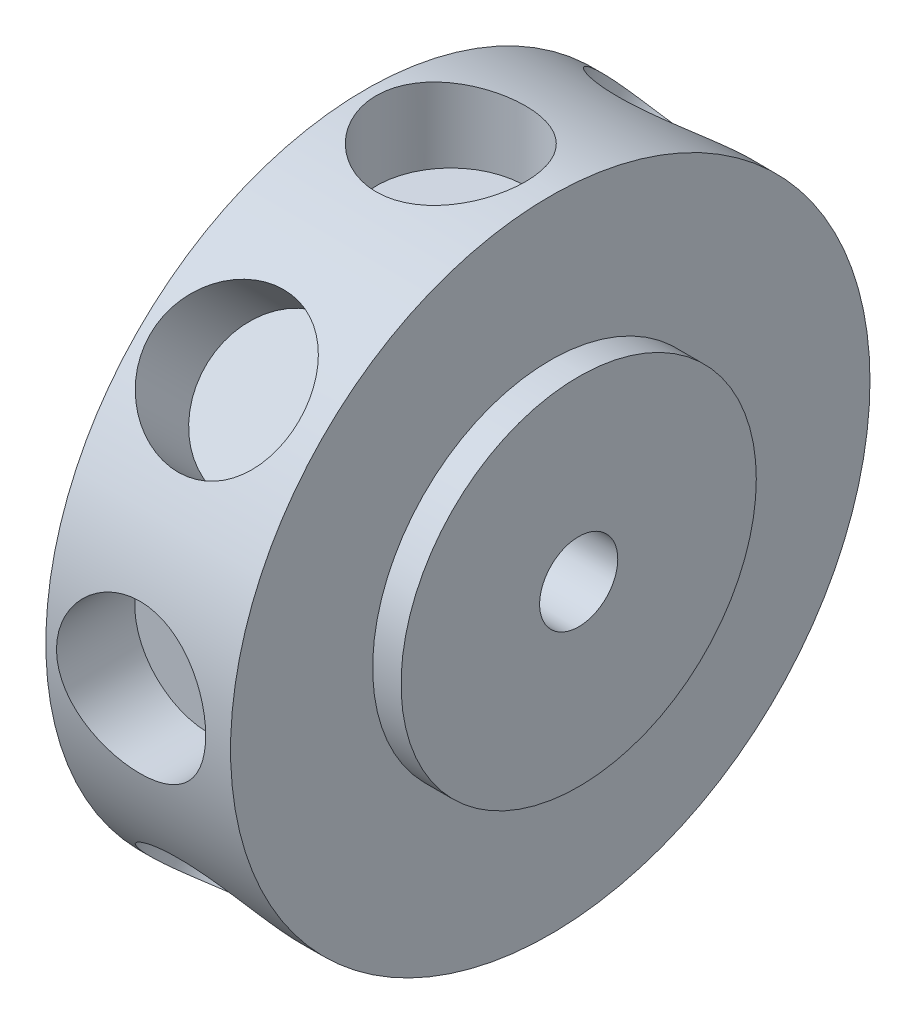
from build123d import *

# Parameters (mm, degrees)
SKETCH1_R               = 22.5
BOSS_EXTRUDE1_DEPTH     = 15
SKETCH2_R               = 2.75
CUT_EXTRUDE1_DEPTH      = 36.178118199
SKETCH5_R               = 8.1
CUT_EXTRUDE2_DEPTH      = 5.5
SKETCH6_R               = 5.25
CUT_EXTRUDE3_DEPTH      = 5.5
CIRPATTERN1_COUNT       = 8
SKETCH29_R              = 22.5
SKETCH29_R_2            = 12.5
CUT_EXTRUDE_THIN1_DEPTH = 2


with BuildPart() as part:
    # Sketch1 → Boss-Extrude1 (new body)
    with BuildSketch(Plane(origin=(0, 0, 0), x_dir=(0, 0, -1), z_dir=(1, 0, 0))):
        Circle(SKETCH1_R)
    extrude(amount=-BOSS_EXTRUDE1_DEPTH)

    # Sketch2 → Cut-Extrude1 (cut, through all)
    with BuildSketch(Plane(origin=(0, 0, 0), x_dir=(0, 0, -1), z_dir=(1, 0, 0))):
        Circle(SKETCH2_R)
    extrude(amount=-CUT_EXTRUDE1_DEPTH, mode=Mode.SUBTRACT)

    # Sketch5 → Cut-Extrude2 (cut)
    with BuildSketch(Plane.ZY.offset(15)):
        Circle(SKETCH5_R)
    extrude(amount=-CUT_EXTRUDE2_DEPTH, mode=Mode.SUBTRACT)

    # Sketch6 → Cut-Extrude3 (cut)
    with BuildSketch(Plane.XY.offset(22.5)):
        with Locations((-9, 0)):
            Circle(SKETCH6_R)
    cut_extrude3 = extrude(amount=-CUT_EXTRUDE3_DEPTH, mode=Mode.SUBTRACT)

    # CirPattern1: Cut-Extrude3 ×8 about axis
    cirpattern1_axis = Axis((0, 0, 0), (1, 0, 0))
    for i in range(1, CIRPATTERN1_COUNT):
        add(cut_extrude3.rotate(cirpattern1_axis, i * 360 / CIRPATTERN1_COUNT), mode=Mode.SUBTRACT)

    # Sketch29 → Cut-Extrude-Thin1 (cut)
    with BuildSketch(Plane(origin=(0, 0, 0), x_dir=(0, 0, -1), z_dir=(1, 0, 0))):
        Circle(SKETCH29_R)
        Circle(SKETCH29_R_2, mode=Mode.SUBTRACT)
    extrude(amount=-CUT_EXTRUDE_THIN1_DEPTH, mode=Mode.SUBTRACT)


solid = part.part
